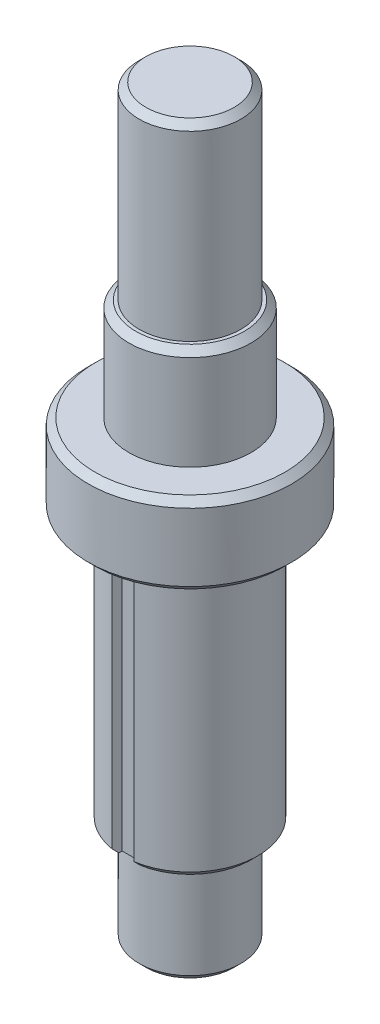
from build123d import *

# Parameters (mm, degrees)
SKETCH2_W          = 3.25
SKETCH2_H          = 3.25
CUT_EXTRUDE1_DEPTH = 40
CHAMFER1_SIZE      = 1
SKETCH3_W          = 3.25
SKETCH3_H          = 3.25
CUT_EXTRUDE2_DEPTH = 15


with BuildPart() as part:
    # Sketch1 → Revolve1 (revolve)
    with BuildSketch(Plane.XY, mode=Mode.PRIVATE) as revolve1_sk:
        Polygon((0, 0), (7.5, 0), (7.5, 15), (10, 15), (10, 55), (15, 55), (15, 67), (9, 67), (9, 82), (7.5, 82), (7.5, 109.85), (0, 109.85), align=None)
    revolve(revolve1_sk.sketch.rotate(Axis((0, 109.85, 0), (0, -1, 0)), 180), axis=Axis((0, 109.85, 0), (0, -1, 0)))

    # Sketch2 → Cut-Extrude1 (cut)
    with BuildSketch(Plane.XZ.offset(-15)):
        with Locations((0, 10)):
            Rectangle(SKETCH2_W, SKETCH2_H)
    extrude(amount=-CUT_EXTRUDE1_DEPTH, mode=Mode.SUBTRACT)

    # Chamfer1
    chamfer1_edges = [part.edges().sort_by_distance(p)[0] for p in [
        (15, 67, 0),
        (15, 55, 0),
        (7.5, 0, 0),
        (0, 15, -10),
        (7.5, 109.85, 0),
        (9, 82, 0),
    ]]
    chamfer(chamfer1_edges, length=CHAMFER1_SIZE)

    # Sketch3 → Cut-Extrude2 (cut)
    with BuildSketch(Plane(origin=(0, 82, 0), x_dir=(1, 0, 0), z_dir=(0, 1, 0))):
        with Locations((0, 9)):
            Rectangle(SKETCH3_W, SKETCH3_H)
    extrude(amount=-CUT_EXTRUDE2_DEPTH, mode=Mode.SUBTRACT)


solid = part.part
